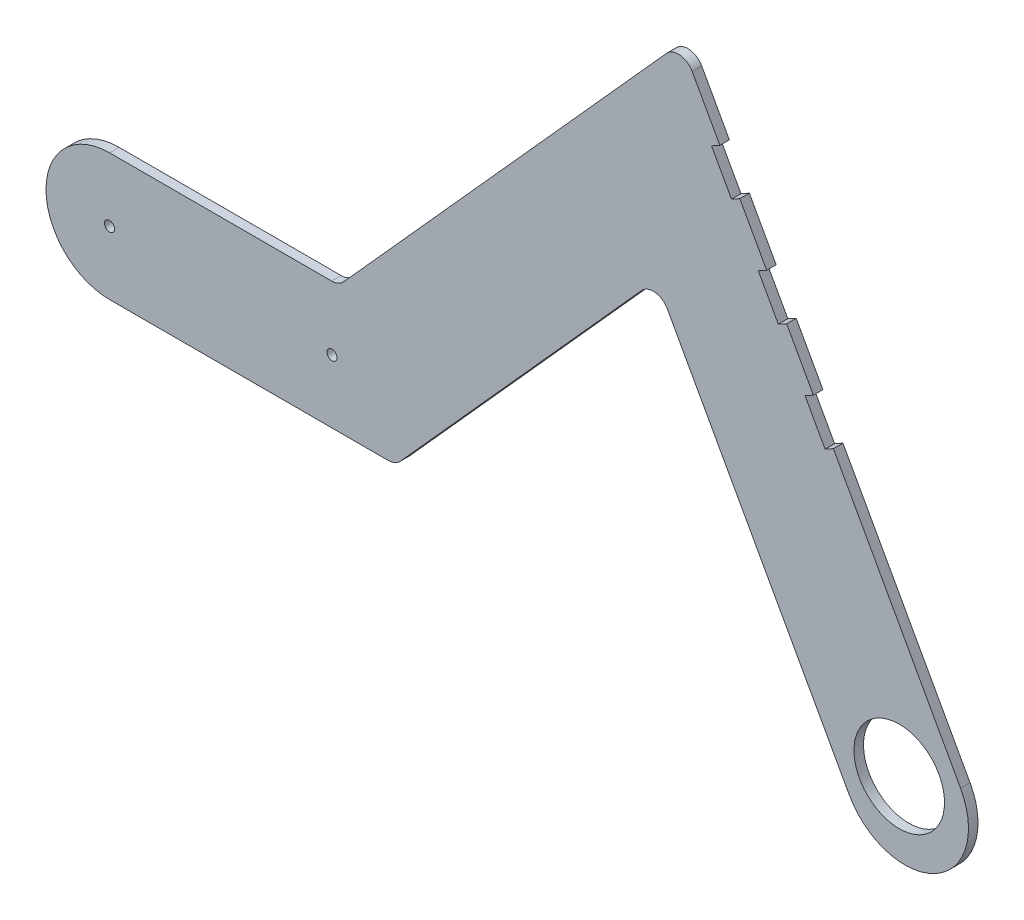
from build123d import *

# Parameters (mm, degrees)
CROQUIS1_R              = 1.58
CROQUIS1_R_2            = 14.25
SALIENTE_EXTRUIR1_DEPTH = 3
CROQUIS3_W              = 3
CROQUIS3_H              = 13.002457907
CROQUIS3_H_2            = 13.048194377
CROQUIS3_H_3            = 13.048194378
CORTAR_EXTRUIR1_DEPTH   = 3


with BuildPart() as part:
    # Croquis1 → Saliente-Extruir1 (new body)
    with BuildSketch(Plane.XY):
        with BuildLine():
            Line((-135.811178416, 31.660861846), (-65.873242367, 31.660861846))
            ThreePointArc((-65.873242367, 31.660861846), (-63.837291884, 32.094144685), (-62.154198363, 33.318899594))
            Line((-62.154198363, 33.318899594), (39.488020824, 146.429658271))
            ThreePointArc((39.488020824, 146.429658271), (43.775922453, 148.055230719), (47.585333219, 145.502393908))
            Line((47.585333219, 145.502393908), (132.043103592, -7.634273033))
            ThreePointArc((132.043103592, -7.634273033), (124.188821584, -34.806138154), (97.016956463, -26.951856146))
            Line((97.016956463, -26.951856146), (39.731279169, 76.917067288))
            ThreePointArc((39.731279169, 76.917067288), (35.921868403, 79.4699041), (31.633966774, 77.844331652))
            Line((31.633966774, 77.844331652), (-44.321252629, -6.681100406))
            ThreePointArc((-44.321252629, -6.681100406), (-46.00434615, -7.905855315), (-48.040296633, -8.339138154))
            Line((-48.040296633, -8.339138154), (-135.811178416, -8.339138154))
            ThreePointArc((-135.811178416, -8.339138154), (-155.811178416, 11.660861846), (-135.811178416, 31.660861846))
        make_face()
        with Locations((-135.811178416, 11.660861846)):
            Circle(CROQUIS1_R, mode=Mode.SUBTRACT)
        with Locations((-65.81121578, 11.5885363)):
            Circle(CROQUIS1_R, mode=Mode.SUBTRACT)
        with Locations((112.738617641, -14.044921514)):
            Circle(CROQUIS1_R_2, mode=Mode.SUBTRACT)
    extrude(amount=SALIENTE_EXTRUIR1_DEPTH)

    # Croquis3 → Cortar-Extruir1 (cut)
    with BuildSketch(Plane(origin=(98.018165522, 54.058873563, 0), x_dir=(0, 0, -1), z_dir=(0.875653678217041, 0.4829395778200074, 0))):
        with Locations((-1.5, 79.927636726)):
            Rectangle(CROQUIS3_W, CROQUIS3_H)
        with Locations((-1.5, 49.42886568)):
            Rectangle(CROQUIS3_W, CROQUIS3_H_2)
        with Locations((-1.5, 18.952962868)):
            Rectangle(CROQUIS3_W, CROQUIS3_H_3)
    extrude(amount=-CORTAR_EXTRUIR1_DEPTH, mode=Mode.SUBTRACT)


solid = part.part
